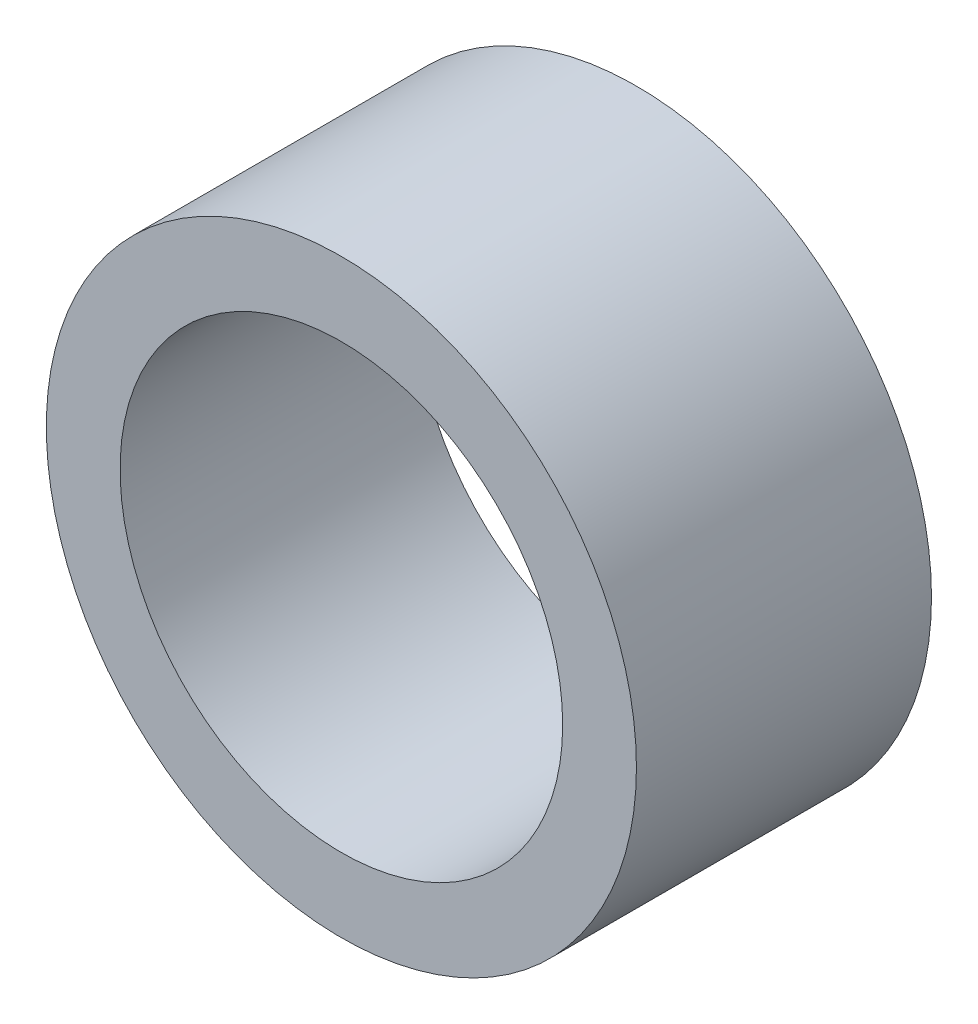
from build123d import *

# Parameters (mm, degrees)
SKETCH_1_R      = 4
SKETCH_1_R_2    = 3
EXTRUDE_1_DEPTH = 4


with BuildPart() as part:
    # 草图1 → 凸台-拉伸1 (new body)
    with BuildSketch(Plane.XY):
        with Locations((0, 10)):
            Circle(SKETCH_1_R)
        with Locations((0, 10)):
            Circle(SKETCH_1_R_2, mode=Mode.SUBTRACT)
    extrude(amount=EXTRUDE_1_DEPTH)


solid = part.part
